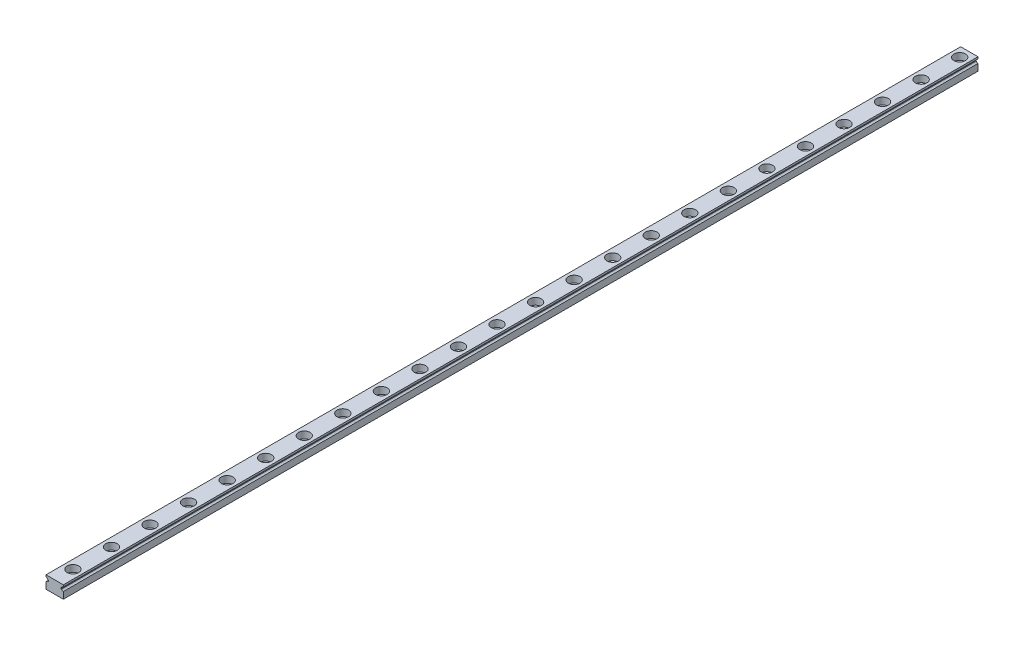
from build123d import *

# Parameters (mm, degrees)
EXTRUDE1_DEPTH     = 600
SKETCH2_R          = 3
EXTRUDE2_DEPTH     = 3.5
SKETCH_R           = 1.75
EXTRUDE3_DEPTH     = 601.052081073
LPATTERN1_COUNT    = 30
LPATTERN1_PITCH    = 20
SKETCH3_W          = 9
SKETCH3_H          = 125.528
CUT_EXTRUDE1_DEPTH = 601.052081073


with BuildPart() as part:
    # Sketch1 → Extrude1 (new body)
    with BuildSketch(Plane.XY):
        with BuildLine():
            Line((-4.5, -3.25), (4.5, -3.25))
            Line((4.5, -3.25), (4.5, 0.25))
            ThreePointArc((4.5, 0.25), (3.93077967, 0.427814974), (3.563991137, 0.898023568))
            Line((3.563991137, 0.898023568), (3.235073025, 0.898023568))
            Line((3.235073025, 0.898023568), (3.235073025, 1.601976432))
            Line((3.235073025, 1.601976432), (3.563991137, 1.601976432))
            ThreePointArc((3.563991137, 1.601976432), (3.93077967, 2.072185026), (4.5, 2.25))
            Line((4.5, 2.25), (4.5, 3.25))
            Line((4.5, 3.25), (-4.5, 3.25))
            Line((-4.5, 3.25), (-4.5, 2.25))
            ThreePointArc((-4.5, 2.25), (-3.93077967, 2.072185026), (-3.563991137, 1.601976432))
            Line((-3.563991137, 1.601976432), (-3.235073025, 1.601976432))
            Line((-3.235073025, 1.601976432), (-3.235073025, 0.898023568))
            Line((-3.235073025, 0.898023568), (-3.563991137, 0.898023568))
            ThreePointArc((-3.563991137, 0.898023568), (-3.93077967, 0.427814974), (-4.5, 0.25))
            Line((-4.5, 0.25), (-4.5, -3.25))
        make_face()
    extrude(amount=EXTRUDE1_DEPTH)

    # Sketch2 → Extrude2 (cut)
    with BuildSketch(Plane(origin=(0, 3.25, 0), x_dir=(1, 0, 0), z_dir=(0, 1, 0))):
        with Locations((0, -5)):
            Circle(SKETCH2_R)
    extrude2 = extrude(amount=-EXTRUDE2_DEPTH, mode=Mode.SUBTRACT)

    # Sketch → Extrude3 (cut, through all)
    with BuildSketch(Plane(origin=(0, 3.25, 0), x_dir=(1, 0, 0), z_dir=(0, 1, 0))):
        with Locations((0, -5)):
            Circle(SKETCH_R)
    extrude3 = extrude(amount=-EXTRUDE3_DEPTH, mode=Mode.SUBTRACT)

    # LPattern1: Extrude2, Extrude3 ×30
    with Locations(*[(0, 0, i * LPATTERN1_PITCH) for i in range(1, LPATTERN1_COUNT)]):
        add(extrude2, mode=Mode.SUBTRACT)
        add(extrude3, mode=Mode.SUBTRACT)

    # Sketch3 → Cut-Extrude1 (cut, through all)
    with BuildSketch(Plane(origin=(0, 3.25, 0), x_dir=(1, 0, 0), z_dir=(0, 1, 0))):
        with Locations((0, -537.236)):
            Rectangle(SKETCH3_W, SKETCH3_H)
    extrude(amount=-CUT_EXTRUDE1_DEPTH, mode=Mode.SUBTRACT)


solid = part.part
